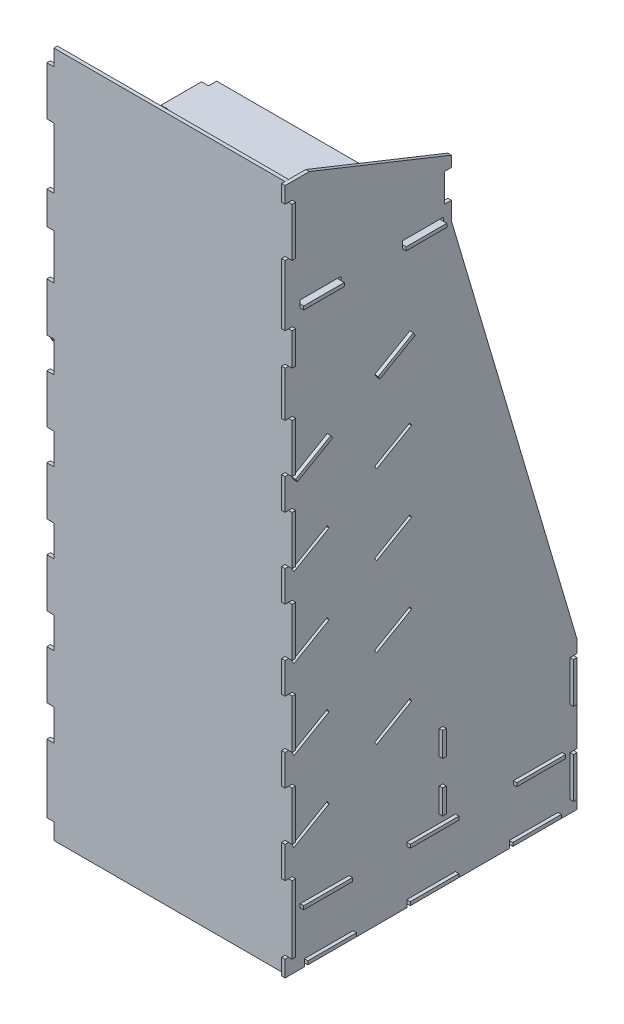
from build123d import *

# Parameters (mm, degrees)
BT_23_P_0101_DEPTH       = 5.499999922
CROQUIS4_W               = 63.5
CROQUIS4_H               = 10.999999844
CROQUIS4_W_2             = 10.999999844
CROQUIS4_H_2             = 44.45
CROQUIS4_H_3             = 63.5
CROQUIS4_H_4             = 76.2
CROQUIS4_W_3             = 76.2
CROQUIS4_H_5             = 5.499999922
CROQUIS4_W_4             = 5.499999922
CROQUIS4_H_6             = 38.1
CROQUIS4_H_7             = 106.497319543
CROQUIS4_H_8             = 50.8
CORTAR_EXTRUIR1_DEPTH    = 1156.942382153
CROQUIS3_W               = 249.350000156
CROQUIS3_H               = 5.499999922
BT_23_P_0102_DEPTH       = 180.975
CROQUIS5_W               = 63.5
CROQUIS5_H               = 5.499999922
SALIENTE_EXTRUIR2_DEPTH  = 10.999999844
SALIENTE_EXTRUIR3_DEPTH  = 180.975
BT_23_P_0103_DEPTH       = 10.999999844
BT_23_P_0104_DEPTH       = 180.975
CROQUIS7_W               = 76.2
CROQUIS7_H               = 5.499999922
SALIENTE_EXTRUIR6_DEPTH  = 10.999999844
BT_23_P_0105_DEPTH       = 180.975
CROQUIS8_W               = 5.499999922
CROQUIS8_H               = 63.5
SALIENTE_EXTRUIR8_DEPTH  = 10.999999844
CROQUIS3_6_W             = 5.499999922
CROQUIS3_6_H             = 141.478
SALIENTE_EXTRUIR9_DEPTH  = 180.975
CROQUIS9_W               = 5.499999922
CROQUIS9_H               = 38.1
SALIENTE_EXTRUIR10_DEPTH = 10.999999844
SALIENTE_EXTRUIR11_DEPTH = 180.975
CROQUIS10_W              = 5.499999922
CROQUIS10_H              = 76.2
CROQUIS10_H_2            = 50.8
CROQUIS10_H_3            = 106.497319543
SALIENTE_EXTRUIR12_DEPTH = 10.999999844
CROQUIS3_8_W             = 435.200000312
CROQUIS3_8_H             = 5.499999922
SALIENTE_EXTRUIR13_DEPTH = 180.975
CROQUIS11_W              = 76.2
CROQUIS11_H              = 5.499999922
SALIENTE_EXTRUIR14_DEPTH = 10.999999844
SALIENTE_EXTRUIR15_DEPTH = 5.499999922


with BuildPart() as part:
    # Croquis2 → BT-23-P-0101 (new body)
    with BuildSketch(Plane(origin=(0, 0, 0), x_dir=(0, 0, -1), z_dir=(1, 0, 0))):
        Polygon((0, 1061.668828241), (38.1, 1061.668828241), (260.35, 972.768828241), (260.35, 883.868828241), (457.2, 217.678), (457.2, -12.7), (0, -12.7), align=None)
    extrude(amount=BT_23_P_0101_DEPTH)

    # Croquis4 → Cortar-Extruir1 (cut, through all)
    with BuildSketch(Plane.ZY):
        with Locations((-215.9, 889.368828163)):
            Rectangle(CROQUIS4_W, CROQUIS4_H)
        with Locations((-55.449999844, 889.368828163)):
            Rectangle(CROQUIS4_W, CROQUIS4_H)
        Polygon((-195.320587333, 767.077692472), (-198.070587294, 762.314552819), (-143.077974153, 730.564552819), (-140.327974192, 735.327692472), align=None)
        Polygon((-65.992612984, 692.410151668), (-68.742612945, 687.647012015), (-13.749999805, 655.897012015), (-10.999999844, 660.660151668), align=None)
        Polygon((-195.320587333, 642.427769354), (-198.070587294, 637.664629701), (-143.077974153, 605.914629701), (-140.327974192, 610.677769354), align=None)
        Polygon((-65.992612984, 567.76022855), (-68.742612945, 562.997088897), (-13.749999805, 531.247088897), (-10.999999844, 536.01022855), align=None)
        Polygon((-195.320587333, 517.777846236), (-198.070587294, 513.014706583), (-143.077974153, 481.264706583), (-140.327974192, 486.027846236), align=None)
        Polygon((-65.992612984, 443.110305432), (-68.742612945, 438.347165779), (-13.749999805, 406.597165779), (-10.999999844, 411.360305432), align=None)
        Polygon((-195.320587333, 393.127923118), (-198.070587294, 388.364783465), (-143.077974153, 356.614783465), (-140.327974192, 361.377923118), align=None)
        Polygon((-65.992612984, 318.460382314), (-68.742612945, 313.697242661), (-13.749999805, 281.947242661), (-10.999999844, 286.710382314), align=None)
        Polygon((-195.320587333, 268.478), (-198.070587294, 263.714860347), (-143.077974153, 231.964860347), (-140.327974192, 236.728), align=None)
        Polygon((-65.992612984, 193.810459196), (-68.742612945, 189.047319543), (-13.749999805, 157.297319543), (-10.999999844, 162.060459196), align=None)
        with Locations((-254.850000078, 933.818828163)):
            Rectangle(CROQUIS4_W_2, CROQUIS4_H_2)
        with Locations((-451.700000078, 166.878)):
            Rectangle(CROQUIS4_W_2, CROQUIS4_H_3)
        with Locations((-451.700000078, 38.1)):
            Rectangle(CROQUIS4_W_2, CROQUIS4_H_3)
        with Locations((-5.499999922, 705.144989954)):
            Rectangle(CROQUIS4_W_2, CROQUIS4_H_4)
        with Locations((-389.050000156, -7.200000078)):
            Rectangle(CROQUIS4_W_3, CROQUIS4_H)
        with Locations((-228.6, -7.200000078)):
            Rectangle(CROQUIS4_W_3, CROQUIS4_H)
        with Locations((-68.149999844, -7.200000078)):
            Rectangle(CROQUIS4_W_3, CROQUIS4_H)
        with Locations((-395.400000156, 73.450000039)):
            Rectangle(CROQUIS4_W_3, CROQUIS4_H_5)
        with Locations((-228.6, 73.450000039)):
            Rectangle(CROQUIS4_W_3, CROQUIS4_H_5)
        with Locations((-61.799999844, 73.450000039)):
            Rectangle(CROQUIS4_W_3, CROQUIS4_H_5)
        with Locations((-244.049999961, 185.928)):
            Rectangle(CROQUIS4_W_4, CROQUIS4_H_6)
        with Locations((-244.049999961, 107.95)):
            Rectangle(CROQUIS4_W_4, CROQUIS4_H_6)
        with Locations((-5.499999922, 998.168828241)):
            Rectangle(CROQUIS4_W_2, CROQUIS4_H_4)
        with Locations((-5.499999922, 580.495066836)):
            Rectangle(CROQUIS4_W_2, CROQUIS4_H_4)
        with Locations((-5.499999922, 455.845143718)):
            Rectangle(CROQUIS4_W_2, CROQUIS4_H_4)
        with Locations((-5.499999922, 331.1952206)):
            Rectangle(CROQUIS4_W_2, CROQUIS4_H_4)
        with Locations((-5.499999922, 206.545297482)):
            Rectangle(CROQUIS4_W_2, CROQUIS4_H_4)
        with Locations((-5.499999922, 65.948659772)):
            Rectangle(CROQUIS4_W_2, CROQUIS4_H_7)
        with Locations((-5.499999922, 839.418828241)):
            Rectangle(CROQUIS4_W_2, CROQUIS4_H_8)
    extrude(amount=-CORTAR_EXTRUIR1_DEPTH, mode=Mode.SUBTRACT)


with BuildPart() as body_2:
    # Croquis3 → BT-23-P-0102 (new body)
    with BuildSketch(Plane.ZY):
        with Locations((-135.674999922, 886.618828202)):
            Rectangle(CROQUIS3_W, CROQUIS3_H)
    extrude(amount=BT_23_P_0102_DEPTH)

    # Croquis5 → Saliente-Extruir2 (add)
    with BuildSketch(Plane(origin=(0, 0, 0), x_dir=(0, 0, -1), z_dir=(1, 0, 0))):
        with Locations((215.9, 886.618828202)):
            Rectangle(CROQUIS5_W, CROQUIS5_H)
        with Locations((55.449999844, 886.618828202)):
            Rectangle(CROQUIS5_W, CROQUIS5_H)
    extrude(amount=SALIENTE_EXTRUIR2_DEPTH)

    # Simetría5: body 2 across plane


with BuildPart() as body_2_1:
    add(body_2.part)
    add(body_2.part.mirror(Plane(origin=(-180.975, 0, 0), x_dir=(0, 0, 1), z_dir=(1, 0, 0))))


with BuildPart() as body_3:
    # Croquis3<3> → Saliente-Extruir3 (new body)
    with BuildSketch(Plane.ZY):
        Polygon((-13.749999805, 655.897012015), (-10.999999844, 660.660151668), (-195.320587333, 767.077692472), (-198.070587294, 762.314552819), align=None)
    extrude(amount=SALIENTE_EXTRUIR3_DEPTH)

    # Croquis6 → BT-23-P-0103 (add)
    with BuildSketch(Plane(origin=(0, 0, 0), x_dir=(0, 0, -1), z_dir=(1, 0, 0))):
        Polygon((195.320587333, 767.077692472), (198.070587294, 762.314552819), (143.077974153, 730.564552819), (140.327974192, 735.327692472), align=None)
        Polygon((65.992612984, 692.410151668), (68.742612945, 687.647012015), (13.749999805, 655.897012015), (10.999999844, 660.660151668), align=None)
    extrude(amount=BT_23_P_0103_DEPTH)

    # Simetría7: body 3 across plane


with BuildPart() as body_3_1:
    add(body_3.part)
    add(body_3.part.mirror(Plane(origin=(-180.975, 0, 0), x_dir=(0, 0, 1), z_dir=(1, 0, 0))))


with BuildPart() as body_4:
    # Croquis3<4> → BT-23-P-0104 (new body)
    with BuildSketch(Plane.ZY):
        Polygon((-10.999999844, 70.700000078), (-10.999999844, 76.2), (-241.3, 76.2), (-246.799999922, 76.2), (-446.200000156, 76.2), (-446.200000156, 70.700000078), align=None)
    extrude(amount=BT_23_P_0104_DEPTH)

    # Croquis7 → Saliente-Extruir6 (add)
    with BuildSketch(Plane(origin=(0, 0, 0), x_dir=(0, 0, -1), z_dir=(1, 0, 0))):
        with Locations((395.400000156, 73.450000039)):
            Rectangle(CROQUIS7_W, CROQUIS7_H)
        with Locations((228.6, 73.450000039)):
            Rectangle(CROQUIS7_W, CROQUIS7_H)
        with Locations((61.799999844, 73.450000039)):
            Rectangle(CROQUIS7_W, CROQUIS7_H)
    extrude(amount=SALIENTE_EXTRUIR6_DEPTH)

    # Simetría8: body 4 across plane


with BuildPart() as body_4_1:
    add(body_4.part)
    add(body_4.part.mirror(Plane(origin=(-180.975, 0, 0), x_dir=(0, 0, 1), z_dir=(1, 0, 0))))


with BuildPart() as body_5:
    # Croquis3<5> → BT-23-P-0105 (new body)
    with BuildSketch(Plane.ZY):
        Polygon((-446.200000156, -1.700000156), (-446.200000156, 70.700000078), (-446.200000156, 76.2), (-446.200000156, 217.678), (-451.700000078, 217.678), (-451.700000078, -12.7), (-446.200000156, -12.7), (-446.200000156, -7.200000078), align=None)
    extrude(amount=BT_23_P_0105_DEPTH)

    # Croquis8 → Saliente-Extruir8 (add)
    with BuildSketch(Plane(origin=(0, 0, 0), x_dir=(0, 0, -1), z_dir=(1, 0, 0))):
        with Locations((448.950000117, 166.878)):
            Rectangle(CROQUIS8_W, CROQUIS8_H)
        with Locations((448.950000117, 38.1)):
            Rectangle(CROQUIS8_W, CROQUIS8_H)
    extrude(amount=SALIENTE_EXTRUIR8_DEPTH)

    # Simetría9: body 5 across plane


with BuildPart() as body_5_1:
    add(body_5.part)
    add(body_5.part.mirror(Plane(origin=(-180.975, 0, 0), x_dir=(0, 0, 1), z_dir=(1, 0, 0))))


with BuildPart() as body_6:
    # Croquis3<6> → Saliente-Extruir9 (new body)
    with BuildSketch(Plane.ZY):
        with Locations((-244.049999961, 146.939)):
            Rectangle(CROQUIS3_6_W, CROQUIS3_6_H)
    extrude(amount=SALIENTE_EXTRUIR9_DEPTH)

    # Croquis9 → Saliente-Extruir10 (add)
    with BuildSketch(Plane(origin=(0, 0, 0), x_dir=(0, 0, -1), z_dir=(1, 0, 0))):
        with Locations((244.049999961, 185.928)):
            Rectangle(CROQUIS9_W, CROQUIS9_H)
        with Locations((244.049999961, 107.95)):
            Rectangle(CROQUIS9_W, CROQUIS9_H)
    extrude(amount=SALIENTE_EXTRUIR10_DEPTH)

    # Simetría10: body 6 across plane


with BuildPart() as body_6_1:
    add(body_6.part)
    add(body_6.part.mirror(Plane(origin=(-180.975, 0, 0), x_dir=(0, 0, 1), z_dir=(1, 0, 0))))


with BuildPart() as body_7:
    # Croquis3<7> → Saliente-Extruir11 (new body)
    with BuildSketch(Plane.ZY):
        Polygon((-10.999999844, 660.660151668), (-10.999999844, 536.01022855), (-10.999999844, 411.360305432), (-10.999999844, 286.710382314), (-10.999999844, 162.060459196), (-10.999999844, 76.2), (-10.999999844, 70.700000078), (-10.999999844, -1.700000156), (-10.999999844, -7.200000078), (-10.999999844, -12.7), (-5.499999922, -12.7), (-5.499999922, 1061.668828241), (-10.999999844, 1061.668828241), (-10.999999844, 894.868828085), (-10.999999844, 889.368828163), (-10.999999844, 883.868828241), align=None)
    extrude(amount=SALIENTE_EXTRUIR11_DEPTH)

    # Croquis10 → Saliente-Extruir12 (add)
    with BuildSketch(Plane(origin=(0, 0, 0), x_dir=(0, 0, -1), z_dir=(1, 0, 0))):
        with Locations((8.249999883, 998.168828241)):
            Rectangle(CROQUIS10_W, CROQUIS10_H)
        with Locations((8.249999883, 839.418828241)):
            Rectangle(CROQUIS10_W, CROQUIS10_H_2)
        with Locations((8.249999883, 705.144989954)):
            Rectangle(CROQUIS10_W, CROQUIS10_H)
        with Locations((8.249999883, 580.495066836)):
            Rectangle(CROQUIS10_W, CROQUIS10_H)
        with Locations((8.249999883, 455.845143718)):
            Rectangle(CROQUIS10_W, CROQUIS10_H)
        with Locations((8.249999883, 331.1952206)):
            Rectangle(CROQUIS10_W, CROQUIS10_H)
        with Locations((8.249999883, 206.545297482)):
            Rectangle(CROQUIS10_W, CROQUIS10_H)
        with Locations((8.249999883, 65.948659772)):
            Rectangle(CROQUIS10_W, CROQUIS10_H_3)
    extrude(amount=SALIENTE_EXTRUIR12_DEPTH)

    # Simetría11: body 7 across plane


with BuildPart() as body_7_1:
    add(body_7.part)
    add(body_7.part.mirror(Plane(origin=(-180.975, 0, 0), x_dir=(0, 0, 1), z_dir=(1, 0, 0))))


with BuildPart() as body_8:
    # Croquis3<8> → Saliente-Extruir13 (new body)
    with BuildSketch(Plane.ZY):
        with Locations((-228.6, -4.450000117)):
            Rectangle(CROQUIS3_8_W, CROQUIS3_8_H)
    extrude(amount=SALIENTE_EXTRUIR13_DEPTH)

    # Croquis11 → Saliente-Extruir14 (add)
    with BuildSketch(Plane(origin=(0, 0, 0), x_dir=(0, 0, -1), z_dir=(1, 0, 0))):
        with Locations((68.149999844, -4.450000117)):
            Rectangle(CROQUIS11_W, CROQUIS11_H)
        with Locations((228.6, -4.450000117)):
            Rectangle(CROQUIS11_W, CROQUIS11_H)
        with Locations((389.050000156, -4.450000117)):
            Rectangle(CROQUIS11_W, CROQUIS11_H)
    extrude(amount=SALIENTE_EXTRUIR14_DEPTH)

    # Simetría12: body 8 across plane


with BuildPart() as body_8_1:
    add(body_8.part)
    add(body_8.part.mirror(Plane(origin=(-180.975, 0, 0), x_dir=(0, 0, 1), z_dir=(1, 0, 0))))


with BuildPart() as body_9:
    # Croquis12 → Saliente-Extruir15 (new body)
    with BuildSketch(Plane(origin=(-180.975, 0, 0), x_dir=(0, 0, -1), z_dir=(1, 0, 0))):
        Polygon((198.070587294, 270.065713218), (198.070587294, 883.868828241), (10.999999844, 883.868828241), (10.999999844, 660.660151668), (103.160293588, 713.86892207), (105.910293549, 709.105782417), (10.999999844, 654.309298797), (10.999999844, 536.01022855), (103.160293588, 589.218998952), (105.910293549, 584.455859299), (10.999999844, 529.659375679), (10.999999844, 411.360305432), (103.160293588, 464.569075834), (105.910293549, 459.805936181), (10.999999844, 405.009452561), (10.999999844, 286.710382314), (103.160293588, 339.919152716), (105.910293549, 335.156013063), (10.999999844, 280.359529443), (10.999999844, 162.060459196), (103.160293588, 215.269229598), align=None)
    extrude(amount=SALIENTE_EXTRUIR15_DEPTH)


solid = Compound([part.part, body_2_1.part, body_3_1.part, body_4_1.part, body_5_1.part, body_6_1.part, body_7_1.part, body_8_1.part, body_9.part])
